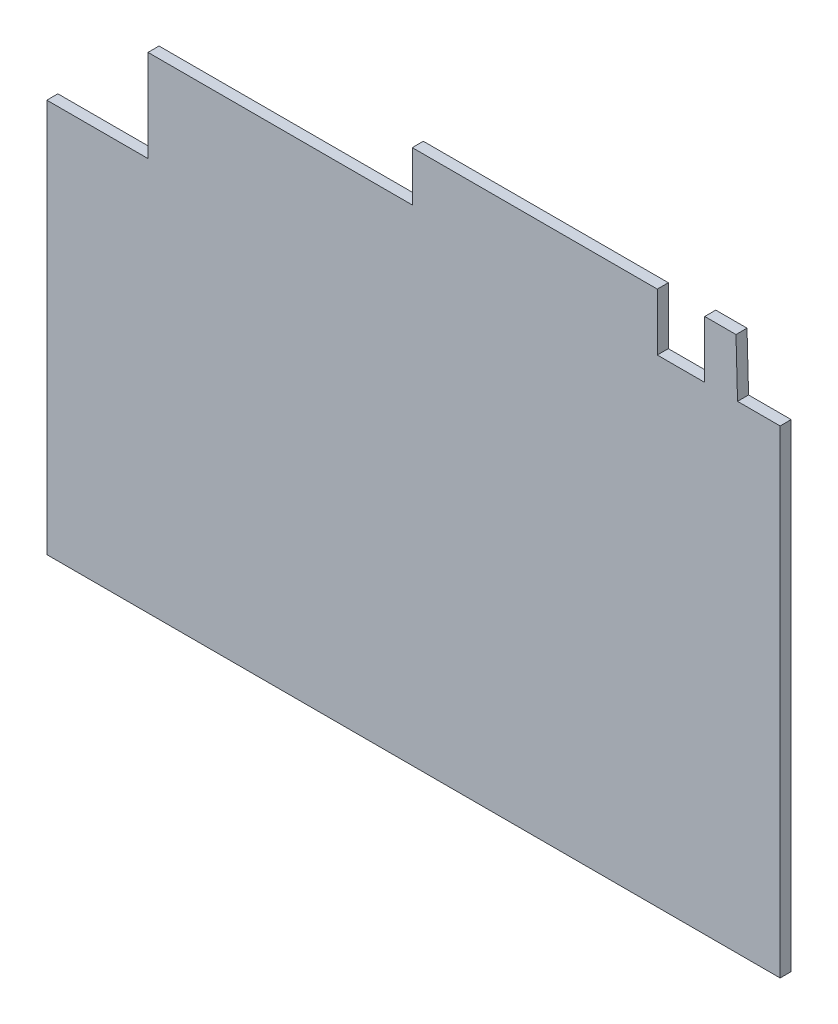
from build123d import *

# Parameters (mm, degrees)
BOSS_EXTRUDE1_DEPTH = 6
SKETCH2_W           = 55
SKETCH2_H           = 50
CUT_EXTRUDE1_DEPTH  = 10


with BuildPart() as part:
    # Sketch1 → Boss-Extrude1 (new body)
    with BuildSketch(Plane.XY):
        Polygon((28.571428571, 236.060202245), (28.571428571, 237.05184048), (5.415486436, 237.05184048), (4.571428571, 268.104761905), (-12.428571429, 268.104761905), (-12.428571429, 237.05184048), (-38.216595912, 237.05184048), (-38.216595912, 268.104761905), (-171.428571429, 268.104761905), (-171.428571429, 241.104761905), (-370.123537574, 241.104761905), (-370.123537574, -22.895238095), (28.571428571, -22.895238095), align=None)
    extrude(amount=BOSS_EXTRUDE1_DEPTH)

    # Sketch2 → Cut-Extrude1 (cut)
    with BuildSketch(Plane.XY.offset(6)):
        with Locations((-342.623537574, 216.104761905)):
            Rectangle(SKETCH2_W, SKETCH2_H)
    extrude(amount=-CUT_EXTRUDE1_DEPTH, mode=Mode.SUBTRACT)


solid = part.part
